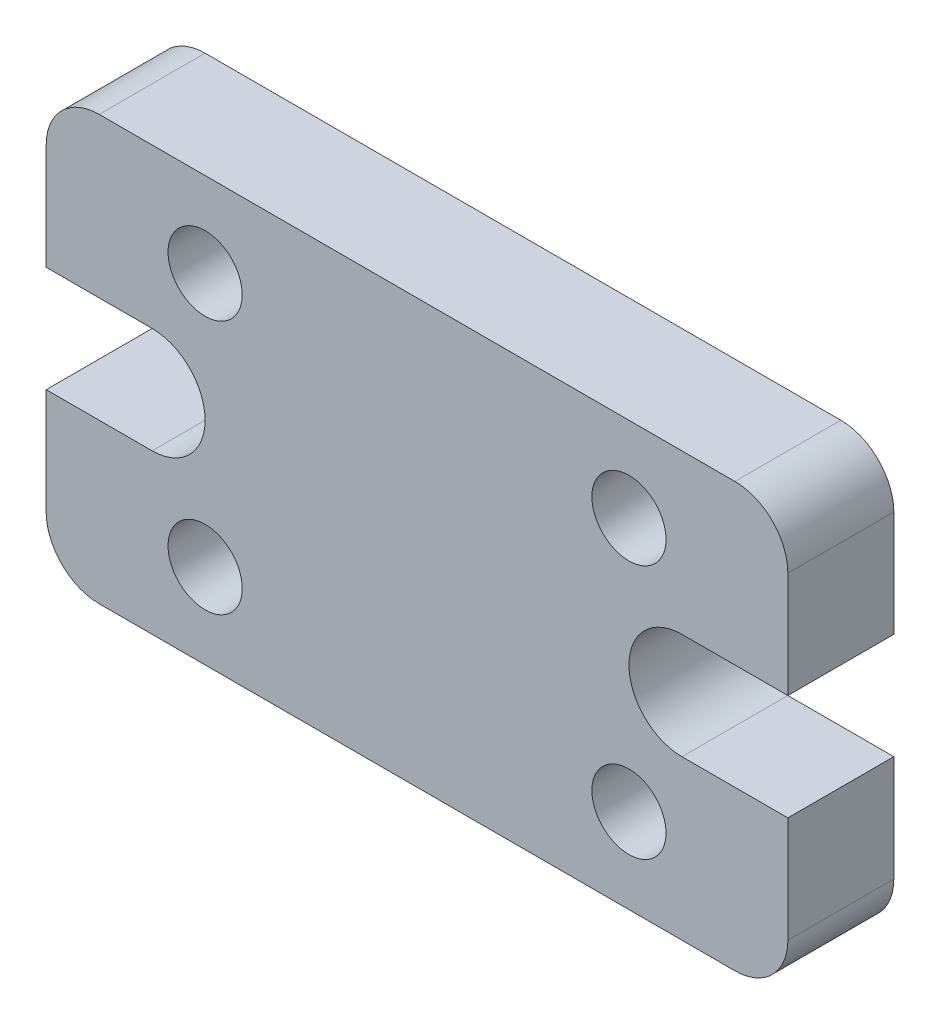
from build123d import *

# Parameters (mm, degrees)
CROQUIS1_R              = 3.5
SALIENTE_EXTRUIR2_DEPTH = 10


with BuildPart() as part:
    # Croquis1 → Saliente-Extruir2 (new body)
    with BuildSketch(Plane.XY):
        with BuildLine():
            Line((-30, 20), (30, 20))
            ThreePointArc((30, 20), (33.535533906, 18.535533906), (35, 15))
            Line((35, 15), (35, 5))
            Line((35, 5), (25, 5))
            ThreePointArc((25, 5), (20, 0), (25, -5))
            Line((25, -5), (35, -5))
            Line((35, -5), (35, -15))
            ThreePointArc((35, -15), (33.535533906, -18.535533906), (30, -20))
            Line((30, -20), (-30, -20))
            ThreePointArc((-30, -20), (-33.535533906, -18.535533906), (-35, -15))
            Line((-35, -15), (-35, -5))
            Line((-35, -5), (-25, -5))
            ThreePointArc((-25, -5), (-20, 0), (-25, 5))
            Line((-25, 5), (-35, 5))
            Line((-35, 5), (-35, 15))
            ThreePointArc((-35, 15), (-33.535533906, 18.535533906), (-30, 20))
        make_face()
        with Locations((20, 12)):
            Circle(CROQUIS1_R, mode=Mode.SUBTRACT)
        with Locations(Location((20, -12, 0), (0, 0, 180))):
            Circle(CROQUIS1_R, mode=Mode.SUBTRACT)
        with Locations((-20, -12)):
            Circle(CROQUIS1_R, mode=Mode.SUBTRACT)
        with Locations(Location((-20, 12, 0), (0, 0, 180))):
            Circle(CROQUIS1_R, mode=Mode.SUBTRACT)
    extrude(amount=SALIENTE_EXTRUIR2_DEPTH)


solid = part.part
